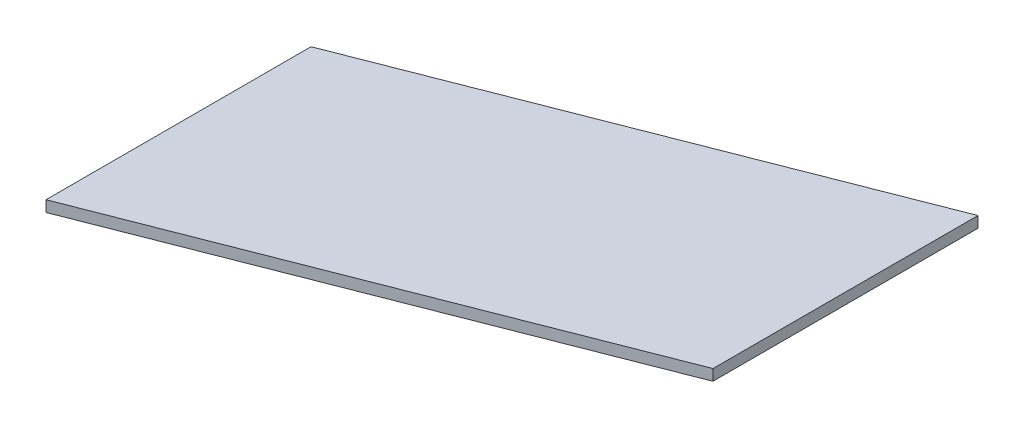
from build123d import *

# Parameters (mm, degrees)
BOSS_EXTRUDE1_DEPTH = 3.175


with BuildPart() as part:
    # Sketch1 → Boss-Extrude1 (new body)
    with BuildSketch(Plane(origin=(0, 0, 0), x_dir=(1, 0, 0), z_dir=(0, 1, 0))):
        Polygon((0, 0), (0, 76.2), (137.922, 130.048), (137.922, 53.848), align=None)
    extrude(amount=BOSS_EXTRUDE1_DEPTH)


solid = part.part
